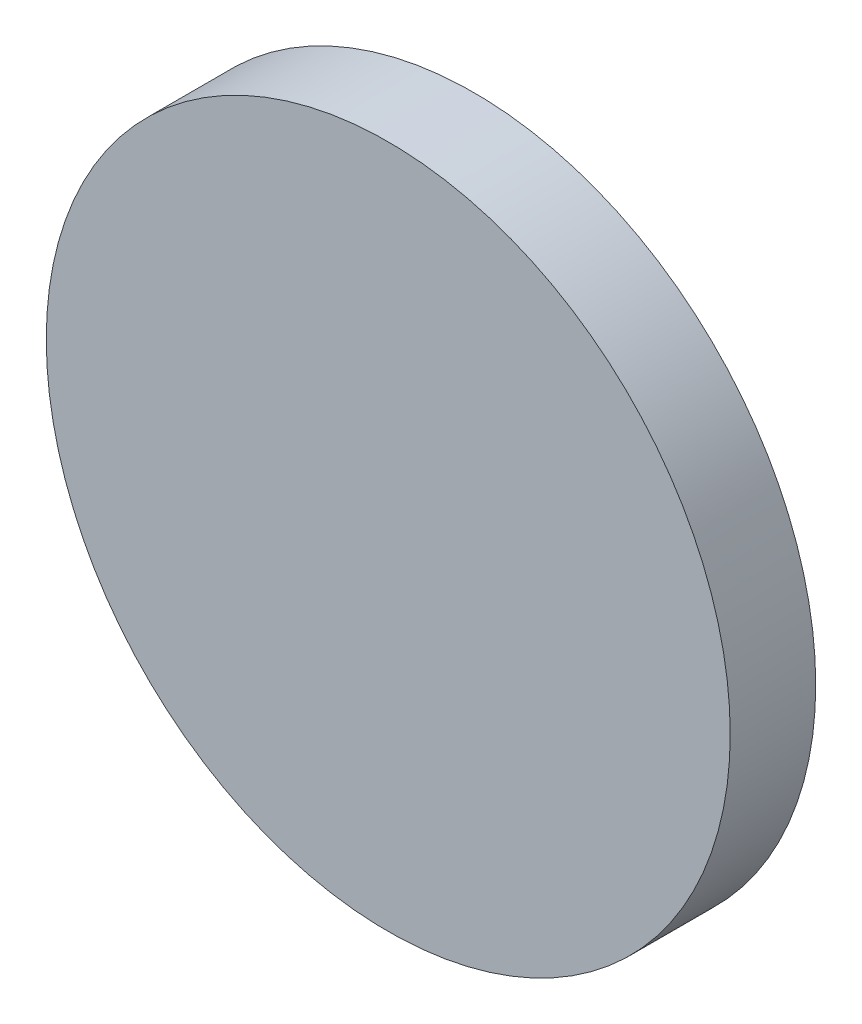
from build123d import *

# Parameters (mm, degrees)
SKETCH_1_R      = 40
EXTRUDE_1_DEPTH = 10


with BuildPart() as part:
    # 草图1 → 凸台-拉伸1 (new body)
    with BuildSketch(Plane.XY):
        Circle(SKETCH_1_R)
    extrude(amount=EXTRUDE_1_DEPTH)


solid = part.part
